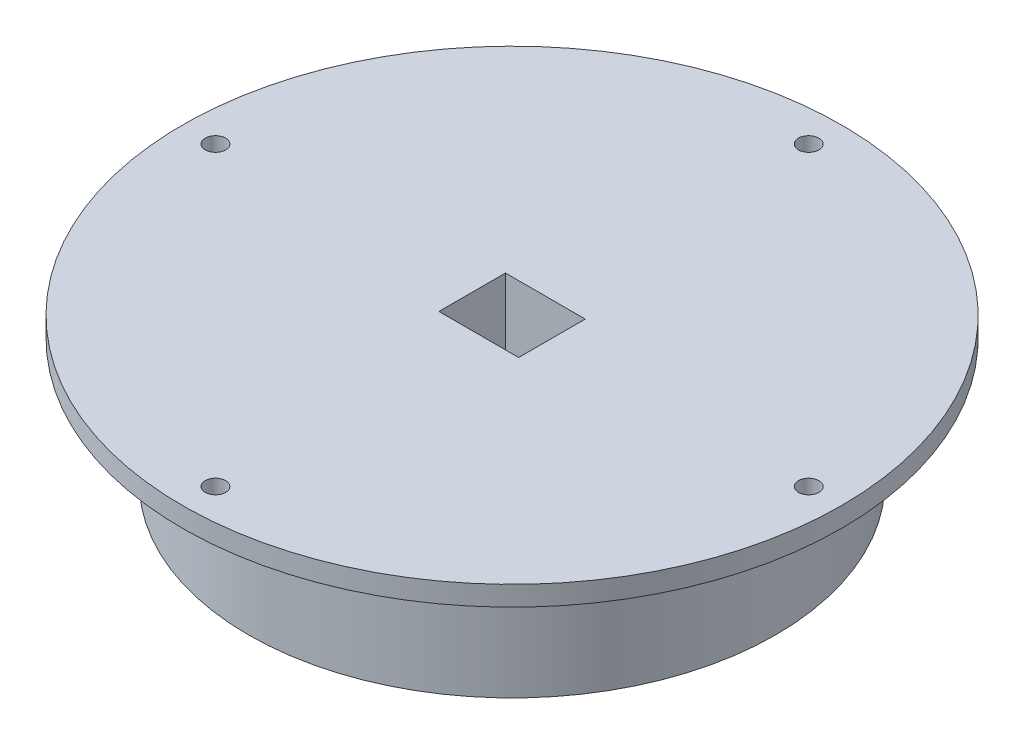
from build123d import *

# Parameters (mm, degrees)
ESQUISSE2_W             = 12.1
ESQUISSE2_H             = 10.1
ENL_V_MAT_EXTRU_1_DEPTH = 21.3
ESQUISSE3_R             = 1.55
ENL_V_MAT_EXTRU_2_DEPTH = 21.3
ESQUISSE5_R             = 4.25
ENL_V_MAT_EXTRU_3_DEPTH = 21.3


with BuildPart() as part:
    # Esquisse1 → Révolution1 (revolve)
    with BuildSketch(Plane.XY):
        Polygon((0, 0), (40, 0), (40, 19), (50, 19), (50, 22), (40, 22), (0, 22), align=None)
    revolve(axis=Axis((0, 0, 0), (0, 1, 0)))

    # Esquisse2 → Enlèv. mat.-Extru.1 (cut)
    with BuildSketch(Plane(origin=(0, 22, 0), x_dir=(1, 0, 0), z_dir=(0, 1, 0))):
        Rectangle(ESQUISSE2_W, ESQUISSE2_H)
    extrude(amount=-ENL_V_MAT_EXTRU_1_DEPTH, mode=Mode.SUBTRACT)

    # Esquisse3 → Enlèv. mat.-Extru.2 (cut)
    with BuildSketch(Plane(origin=(0, 22, 0), x_dir=(1, 0, 0), z_dir=(0, 1, 0))):
        with Locations(Location((45, 0, 0), (0, 0, 180))):
            Circle(ESQUISSE3_R)
        with Locations((-45, 0)):
            Circle(ESQUISSE3_R)
        with Locations(Location((0, 45, 0), (0, 0, 180))):
            Circle(ESQUISSE3_R)
        with Locations((0, -45)):
            Circle(ESQUISSE3_R)
    extrude(amount=-ENL_V_MAT_EXTRU_2_DEPTH, mode=Mode.SUBTRACT)

    # Esquisse5 → Enlèv. mat.-Extru.3 (cut)
    with BuildSketch(Plane(origin=(0, 0.7, 0), x_dir=(1, 0, 0), z_dir=(0, 1, 0))):
        with Locations(Location((0, 0, 0), (0, 0, 180))):
            Circle(ESQUISSE5_R)
    extrude(amount=-ENL_V_MAT_EXTRU_3_DEPTH, mode=Mode.SUBTRACT)


solid = part.part
